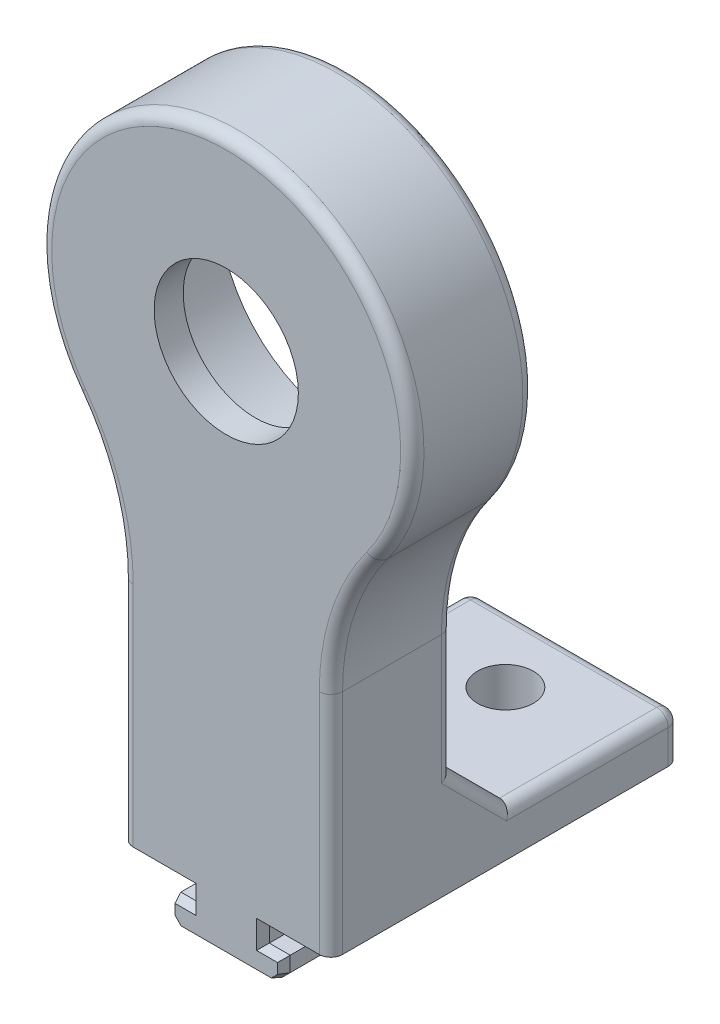
from build123d import *
from OCP.BRepFilletAPI import BRepFilletAPI_MakeChamfer

# Parameters (mm, degrees)
SKETCH_1_R          = 6.2
EXTRUDE_1_DEPTH     = 2.5
EXTRUDE_START       = -8
SKETCH_1_13_R       = 11.1
SKETCH_1_13_R_2     = 6.2
EXTRUDE_5_DEPTH     = 8
EXTRUDE_START_2     = -7.5
EXTRUDE_2_DEPTH     = 20
EXTRUDE_3_DEPTH     = 15.5
SKETCH_4_R          = 2.4
CUT_EXTRUDE_3_DEPTH = 62.816259997
CUT_EXTRUDE_5_DEPTH = 0.1
CHAMFER_3_SIZE      = 0.8
CHAMFER_3_SIZE2     = 0.291176187
CHAMFER_4_SIZE      = 5
FILLET_1_R          = 1


with BuildPart() as part:
    # 草图1 → 凸台-拉伸1 (new body)
    with BuildSketch(Plane.XY):
        with BuildLine():
            Line((2.9, 10), (9, 10))
            Line((9, 10), (9, 29.669270992))
            ThreePointArc((9, 29.669270992), (9.997076248, 35.905366637), (12.888888889, 41.519675997))
            ThreePointArc((12.888888889, 41.519675997), (0, 67), (-12.888888889, 41.519675997))
            ThreePointArc((-12.888888889, 41.519675997), (-9.997076248, 35.905366637), (-9, 29.669270992))
            Line((-9, 29.669270992), (-9, 10))
            Line((-9, 10), (-2.9, 10))
            Line((-2.9, 10), (-2.9, 8))
            Line((-2.9, 8), (-4.7, 8))
            Line((-4.7, 8), (-4.7, 6.7))
            Line((-4.7, 6.7), (-4, 6))
            Line((-4, 6), (4, 6))
            Line((4, 6), (4.7, 6.7))
            Line((4.7, 6.7), (4.7, 8))
            Line((4.7, 8), (2.9, 8))
            Line((2.9, 8), (2.9, 10))
        make_face()
        with Locations((0, 51)):
            Circle(SKETCH_1_R, mode=Mode.SUBTRACT)
    extrude(amount=EXTRUDE_1_DEPTH)

    # 草图1<13> → 凸台-拉伸5 (add)
    # profile 1 of 4: a face of its own
    with BuildSketch(Plane.XY.offset(EXTRUDE_START)):
        Polygon((2.9, 10), (9, 10), (9, 14), (-9, 14), (-9, 10), (-2.9, 10), align=None)
    # profile 2 of 4: a face of its own
    with BuildSketch(Plane.XY.offset(EXTRUDE_START)):
        Polygon((2.9, 8), (2.9, 10), (-2.9, 10), (-2.9, 8), (-4.7, 8), (-4.7, 6.7), (-4, 6), (4, 6), (4.7, 6.7), (4.7, 8), align=None)
    # profile 3 of 4: a face of its own
    with BuildSketch(Plane.XY.offset(EXTRUDE_START)):
        with BuildLine():
            Line((-9, 14), (9, 14))
            Line((9, 14), (9, 29.669270992))
            ThreePointArc((9, 29.669270992), (9.997076248, 35.905366637), (12.888888889, 41.519675997))
            ThreePointArc((12.888888889, 41.519675997), (0, 67), (-12.888888889, 41.519675997))
            ThreePointArc((-12.888888889, 41.519675997), (-9.997076248, 35.905366637), (-9, 29.669270992))
            Line((-9, 29.669270992), (-9, 14))
        make_face()
        with Locations((0, 51)):
            Circle(SKETCH_1_13_R, mode=Mode.SUBTRACT)
    # profile 4 of 4: a face of its own
    with BuildSketch(Plane.XY.offset(EXTRUDE_START)):
        with Locations((0, 51)):
            Circle(SKETCH_1_13_R_2)
    extrude(amount=EXTRUDE_5_DEPTH)


with BuildPart() as extrude_5_kept_piece:
    # of the separate pieces the step leaves, the one the design keeps (extrude_5_pieces_kept)
    add(part.part.solids().sort_by_distance((2.9, 10, 2.5))[0])

    # 草图1<10> → 凸台-拉伸2 (add)
    with BuildSketch(Plane.XY.offset(EXTRUDE_START_2)):
        Polygon((2.9, 10), (9, 10), (9, 14), (-9, 14), (-9, 10), (-2.9, 10), align=None)
    extrude(amount=-EXTRUDE_2_DEPTH)

    # 草图1<11> → 凸台-拉伸3 (add)
    with BuildSketch(Plane.XY):
        Polygon((2.9, 8), (4.7, 8), (4.7, 6.7), (4, 6), (-4, 6), (-4.7, 6.7), (-4.7, 8), (-2.9, 8), (-2.9, 10), (2.9, 10), align=None)
    extrude(amount=-EXTRUDE_3_DEPTH)

    # 草图4 → 切除-拉伸3 (cut, through all)
    with BuildSketch(Plane(origin=(0, 14, 0), x_dir=(1, 0, 0), z_dir=(0, 1, 0))):
        with Locations(Location((0, 21.5, 0), (0, 0, 270))):
            Circle(SKETCH_4_R)
    extrude(amount=-CUT_EXTRUDE_3_DEPTH, mode=Mode.SUBTRACT)

    # 草图7 → 切除-拉伸5 (cut)
    with BuildSketch(Plane.XZ.offset(-10)):
        Polygon((2.9, 2.5), (9, 2.5), (9, -27.5), (-9, -27.5), (-9, 2.5), (-2.9, 2.5), (-2.9, -15.5), (2.9, -15.5), align=None)
    extrude(amount=-CUT_EXTRUDE_5_DEPTH, mode=Mode.SUBTRACT)

    # 倒角3: one chamfer whose edges measure the first distance from different faces: ONE call of the kernel's chamfer builder (chamfer() names one face for all edges)
    chamfer_3_edges_1 = [extrude_5_kept_piece.edges().sort_by_distance(p)[0] for p in [
        (2.9, 9.05, -15.5),
        (2.9, 9.05, 2.5),
    ]]
    chamfer_3_side_1 = [extrude_5_kept_piece.faces().sort_by_distance(p)[0] for p in [
        (2.9, 9.05, -6.5),
    ]]
    chamfer_3_edges_2 = [extrude_5_kept_piece.edges().sort_by_distance(p)[0] for p in [
        (4.7, 7.35, -15.5),
        (4.7, 7.35, 2.5),
    ]]
    chamfer_3_side_2 = [extrude_5_kept_piece.faces().sort_by_distance(p)[0] for p in [
        (4.7, 7.35, -6.5),
    ]]
    chamfer_3_edges_3 = [extrude_5_kept_piece.edges().sort_by_distance(p)[0] for p in [
        (4.35, 6.35, -15.5),
        (4.35, 6.35, 2.5),
    ]]
    chamfer_3_side_3 = [extrude_5_kept_piece.faces().sort_by_distance(p)[0] for p in [
        (4.35, 6.35, -6.5),
    ]]
    chamfer_3_edges_4 = [extrude_5_kept_piece.edges().sort_by_distance(p)[0] for p in [
        (3.8, 8, -15.5),
        (3.8, 8, 2.5),
    ]]
    chamfer_3_side_4 = [extrude_5_kept_piece.faces().sort_by_distance(p)[0] for p in [
        (3.8, 8, -6.5),
    ]]
    chamfer_3_edges_5 = [extrude_5_kept_piece.edges().sort_by_distance(p)[0] for p in [
        (0, 6, -15.5),
        (0, 6, 2.5),
    ]]
    chamfer_3_side_5 = [extrude_5_kept_piece.faces().sort_by_distance(p)[0] for p in [
        (0, 6, -6.5),
    ]]
    chamfer_3_edges_6 = [extrude_5_kept_piece.edges().sort_by_distance(p)[0] for p in [
        (-4.35, 6.35, -15.5),
        (-4.35, 6.35, 2.5),
    ]]
    chamfer_3_side_6 = [extrude_5_kept_piece.faces().sort_by_distance(p)[0] for p in [
        (-4.35, 6.35, -6.5),
    ]]
    chamfer_3_edges_7 = [extrude_5_kept_piece.edges().sort_by_distance(p)[0] for p in [
        (-4.7, 7.35, -15.5),
        (-4.7, 7.35, 2.5),
    ]]
    chamfer_3_side_7 = [extrude_5_kept_piece.faces().sort_by_distance(p)[0] for p in [
        (-4.7, 7.35, -6.5),
    ]]
    chamfer_3_edges_8 = [extrude_5_kept_piece.edges().sort_by_distance(p)[0] for p in [
        (-3.8, 8, -15.5),
        (-3.8, 8, 2.5),
    ]]
    chamfer_3_side_8 = [extrude_5_kept_piece.faces().sort_by_distance(p)[0] for p in [
        (-3.8, 8, -6.5),
    ]]
    chamfer_3_edges_9 = [extrude_5_kept_piece.edges().sort_by_distance(p)[0] for p in [
        (-2.9, 9.05, -15.5),
        (-2.9, 9.05, 2.5),
    ]]
    chamfer_3_side_9 = [extrude_5_kept_piece.faces().sort_by_distance(p)[0] for p in [
        (-2.9, 9.05, -6.5),
    ]]
    chamfer_3 = BRepFilletAPI_MakeChamfer(extrude_5_kept_piece.part.solid().wrapped)
    for e in chamfer_3_edges_1:
        chamfer_3.Add(CHAMFER_3_SIZE, CHAMFER_3_SIZE2, e.wrapped, chamfer_3_side_1[0].wrapped)  # the first distance lies on this face
    for e in chamfer_3_edges_2:
        chamfer_3.Add(CHAMFER_3_SIZE, CHAMFER_3_SIZE2, e.wrapped, chamfer_3_side_2[0].wrapped)  # the first distance lies on this face
    for e in chamfer_3_edges_3:
        chamfer_3.Add(CHAMFER_3_SIZE, CHAMFER_3_SIZE2, e.wrapped, chamfer_3_side_3[0].wrapped)  # the first distance lies on this face
    for e in chamfer_3_edges_4:
        chamfer_3.Add(CHAMFER_3_SIZE, CHAMFER_3_SIZE2, e.wrapped, chamfer_3_side_4[0].wrapped)  # the first distance lies on this face
    for e in chamfer_3_edges_5:
        chamfer_3.Add(CHAMFER_3_SIZE, CHAMFER_3_SIZE2, e.wrapped, chamfer_3_side_5[0].wrapped)  # the first distance lies on this face
    for e in chamfer_3_edges_6:
        chamfer_3.Add(CHAMFER_3_SIZE, CHAMFER_3_SIZE2, e.wrapped, chamfer_3_side_6[0].wrapped)  # the first distance lies on this face
    for e in chamfer_3_edges_7:
        chamfer_3.Add(CHAMFER_3_SIZE, CHAMFER_3_SIZE2, e.wrapped, chamfer_3_side_7[0].wrapped)  # the first distance lies on this face
    for e in chamfer_3_edges_8:
        chamfer_3.Add(CHAMFER_3_SIZE, CHAMFER_3_SIZE2, e.wrapped, chamfer_3_side_8[0].wrapped)  # the first distance lies on this face
    for e in chamfer_3_edges_9:
        chamfer_3.Add(CHAMFER_3_SIZE, CHAMFER_3_SIZE2, e.wrapped, chamfer_3_side_9[0].wrapped)  # the first distance lies on this face
    add(Compound.cast(chamfer_3.Shape()), mode=Mode.REPLACE)

    # 倒角4
    chamfer_4_edges = [extrude_5_kept_piece.edges().sort_by_distance(p)[0] for p in [
        (0, 14, -8),
    ]]
    chamfer(chamfer_4_edges, length=CHAMFER_4_SIZE)

    # 圆角1
    fillet_1_edges = [extrude_5_kept_piece.edges().sort_by_distance(p)[0] for p in [
        (-9, 14, -20.25),
        (9, 14, -20.25),
        (0, 14, -27.5),
        (-9, 12.05, -27.5),
        (9, 12.05, -27.5),
        (9, 19.884635496, 2.5),
        (-9, 19.884635496, 2.5),
        (9.997076248, 35.905366637, 2.5),
        (0, 67, 2.5),
        (-9, 24.334635496, -8),
        (9, 24.334635496, -8),
        (9, 16.5, -10.5),
        (-9, 16.5, -10.5),
        (-9.997076248, 35.905366637, 2.5),
        (0, 67, -8),
        (9.997076248, 35.905366637, -8),
        (-9.997076248, 35.905366637, -8),
    ]]
    fillet(fillet_1_edges, radius=FILLET_1_R)


solid = extrude_5_kept_piece.part
